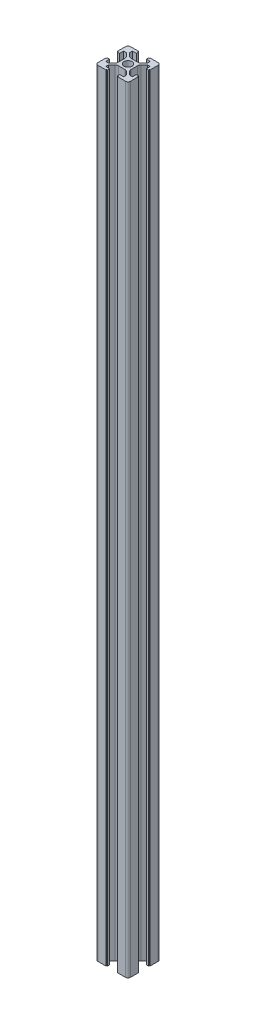
from build123d import *

# Parameters (mm, degrees)
SKETCH1_R           = 2.5
BOSS_EXTRUDE1_DEPTH = 478.02


with BuildPart() as part:
    # Sketch1 → Boss-Extrude1 (new body)
    with BuildSketch(Plane(origin=(0, 0, 0), x_dir=(1, 0, 0), z_dir=(0, 1, 0))):
        with BuildLine():
            Line((-14.000129172, -7.246328066), (-15.300129172, -7.246328066))
            Line((-15.300129172, -7.246328066), (-15.300129172, -7.746328066))
            Line((-15.300129172, -7.746328066), (-15.800129172, -7.746328066))
            Line((-15.800129172, -7.746328066), (-15.800129172, -12.646328066))
            ThreePointArc((-15.800129172, -12.646328066), (-15.360789344, -13.706988238), (-14.300129172, -14.146328066))
            Line((-14.300129172, -14.146328066), (-9.400129172, -14.146328066))
            Line((-9.400129172, -14.146328066), (-9.400129172, -13.646328066))
            Line((-9.400129172, -13.646328066), (-8.900129172, -13.646328066))
            Line((-8.900129172, -13.646328066), (-8.900129172, -12.346328066))
            Line((-8.900129172, -12.346328066), (-11.300129172, -12.346328066))
            Line((-11.300129172, -12.346328066), (-11.300129172, -10.706988238))
            Line((-11.300129172, -10.706988238), (-9.225255438, -8.632114504))
            ThreePointArc((-9.225255438, -8.632114504), (-8.576408741, -8.198569001), (-7.811041876, -8.046328066))
            Line((-7.811041876, -8.046328066), (-3.789216469, -8.046328066))
            ThreePointArc((-3.789216469, -8.046328066), (-3.023849604, -8.198569001), (-2.375002907, -8.632114504))
            Line((-2.375002907, -8.632114504), (-0.300129172, -10.706988238))
            Line((-0.300129172, -10.706988238), (-0.300129172, -12.346328066))
            Line((-0.300129172, -12.346328066), (-2.700129172, -12.346328066))
            Line((-2.700129172, -12.346328066), (-2.700129172, -13.646328066))
            Line((-2.700129172, -13.646328066), (-2.200129172, -13.646328066))
            Line((-2.200129172, -13.646328066), (-2.200129172, -14.146328066))
            Line((-2.200129172, -14.146328066), (2.699870828, -14.146328066))
            ThreePointArc((2.699870828, -14.146328066), (3.760530999, -13.706988238), (4.199870828, -12.646328066))
            Line((4.199870828, -12.646328066), (4.199870828, -7.746328066))
            Line((4.199870828, -7.746328066), (3.699870828, -7.746328066))
            Line((3.699870828, -7.746328066), (3.699870828, -7.246328066))
            Line((3.699870828, -7.246328066), (2.399870828, -7.246328066))
            Line((2.399870828, -7.246328066), (2.399870828, -9.646328066))
            Line((2.399870828, -9.646328066), (0.760530999, -9.646328066))
            Line((0.760530999, -9.646328066), (-1.314342735, -7.571454332))
            ThreePointArc((-1.314342735, -7.571454332), (-1.747888237, -6.922607634), (-1.900129172, -6.15724077))
            Line((-1.900129172, -6.15724077), (-1.900129172, -2.135415363))
            ThreePointArc((-1.900129172, -2.135415363), (-1.747888237, -1.370048498), (-1.314342735, -0.7212018))
            Line((-1.314342735, -0.7212018), (0.760530999, 1.353671934))
            Line((0.760530999, 1.353671934), (2.399870828, 1.353671934))
            Line((2.399870828, 1.353671934), (2.399870828, -1.046328066))
            Line((2.399870828, -1.046328066), (3.699870828, -1.046328066))
            Line((3.699870828, -1.046328066), (3.699870828, -0.546328066))
            Line((3.699870828, -0.546328066), (4.199870828, -0.546328066))
            Line((4.199870828, -0.546328066), (4.199870828, 4.353671934))
            ThreePointArc((4.199870828, 4.353671934), (3.760530999, 5.414332106), (2.699870828, 5.853671934))
            Line((2.699870828, 5.853671934), (-2.200129172, 5.853671934))
            Line((-2.200129172, 5.853671934), (-2.200129172, 5.353671934))
            Line((-2.200129172, 5.353671934), (-2.700129172, 5.353671934))
            Line((-2.700129172, 5.353671934), (-2.700129172, 4.053671934))
            Line((-2.700129172, 4.053671934), (-0.300129172, 4.053671934))
            Line((-0.300129172, 4.053671934), (-0.300129172, 2.414332106))
            Line((-0.300129172, 2.414332106), (-2.375002907, 0.339458372))
            ThreePointArc((-2.375002907, 0.339458372), (-3.023849604, -0.094087131), (-3.789216469, -0.246328066))
            Line((-3.789216469, -0.246328066), (-7.811041876, -0.246328066))
            ThreePointArc((-7.811041876, -0.246328066), (-8.576408741, -0.094087131), (-9.225255438, 0.339458372))
            Line((-9.225255438, 0.339458372), (-11.300129172, 2.414332106))
            Line((-11.300129172, 2.414332106), (-11.300129172, 4.053671934))
            Line((-11.300129172, 4.053671934), (-8.900129172, 4.053671934))
            Line((-8.900129172, 4.053671934), (-8.900129172, 5.353671934))
            Line((-8.900129172, 5.353671934), (-9.400129172, 5.353671934))
            Line((-9.400129172, 5.353671934), (-9.400129172, 5.853671934))
            Line((-9.400129172, 5.853671934), (-14.300129172, 5.853671934))
            ThreePointArc((-14.300129172, 5.853671934), (-15.360789344, 5.414332106), (-15.800129172, 4.353671934))
            Line((-15.800129172, 4.353671934), (-15.800129172, -0.546328066))
            Line((-15.800129172, -0.546328066), (-15.300129172, -0.546328066))
            Line((-15.300129172, -0.546328066), (-15.300129172, -1.046328066))
            Line((-15.300129172, -1.046328066), (-14.000129172, -1.046328066))
            Line((-14.000129172, -1.046328066), (-14.000129172, 1.353671934))
            Line((-14.000129172, 1.353671934), (-12.360789344, 1.353671934))
            Line((-12.360789344, 1.353671934), (-10.28591561, -0.7212018))
            ThreePointArc((-10.28591561, -0.7212018), (-9.852370107, -1.370048498), (-9.700129172, -2.135415363))
            Line((-9.700129172, -2.135415363), (-9.700129172, -6.15724077))
            ThreePointArc((-9.700129172, -6.15724077), (-9.852370107, -6.922607634), (-10.28591561, -7.571454332))
            Line((-10.28591561, -7.571454332), (-12.360789344, -9.646328066))
            Line((-12.360789344, -9.646328066), (-14.000129172, -9.646328066))
            Line((-14.000129172, -9.646328066), (-14.000129172, -7.246328066))
        make_face()
        with Locations(Location((-5.800129172, -4.146328066, 0), (0, 0, 90))):
            Circle(SKETCH1_R, mode=Mode.SUBTRACT)
    extrude(amount=BOSS_EXTRUDE1_DEPTH)


solid = part.part
